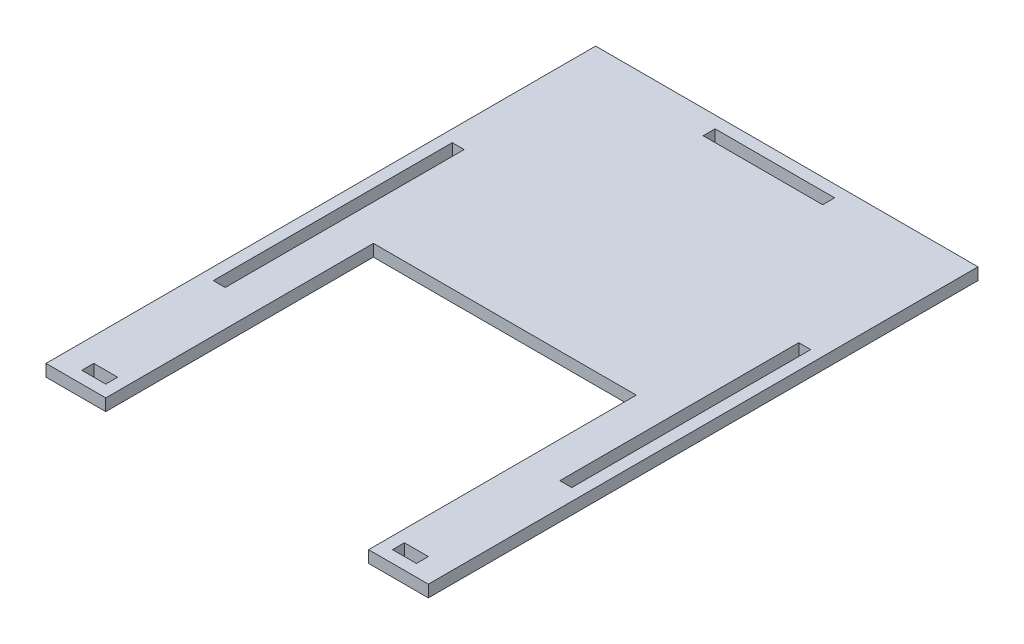
from build123d import *

# Parameters (mm, degrees)
SKETCH1_W           = 31.75
SKETCH1_H           = 3.175
SKETCH1_W_2         = 3.175
SKETCH1_H_2         = 63.5
SKETCH1_W_3         = 6.35
BOSS_EXTRUDE1_DEPTH = 3.175


with BuildPart() as part:
    # Sketch1 → Boss-Extrude1 (new body)
    with BuildSketch(Plane(origin=(0, 0, 0), x_dir=(1, 0, 0), z_dir=(0, 1, 0))):
        Polygon((-50.8, 73.025), (50.8, 73.025), (50.8, -73.025), (34.925, -73.025), (34.925, -1.905), (-34.925, -1.905), (-34.925, -73.025), (-50.8, -73.025), align=None)
        with Locations((0, 68.2625)):
            Rectangle(SKETCH1_W, SKETCH1_H, mode=Mode.SUBTRACT)
        with Locations((-46.0375, 0)):
            Rectangle(SKETCH1_W_2, SKETCH1_H_2, mode=Mode.SUBTRACT)
        with Locations((46.0375, 0)):
            Rectangle(SKETCH1_W_2, SKETCH1_H_2, mode=Mode.SUBTRACT)
        with Locations((-41.275, -68.2625)):
            Rectangle(SKETCH1_W_3, SKETCH1_H, mode=Mode.SUBTRACT)
        with Locations((41.275, -68.2625)):
            Rectangle(SKETCH1_W_3, SKETCH1_H, mode=Mode.SUBTRACT)
    extrude(amount=BOSS_EXTRUDE1_DEPTH)


solid = part.part
